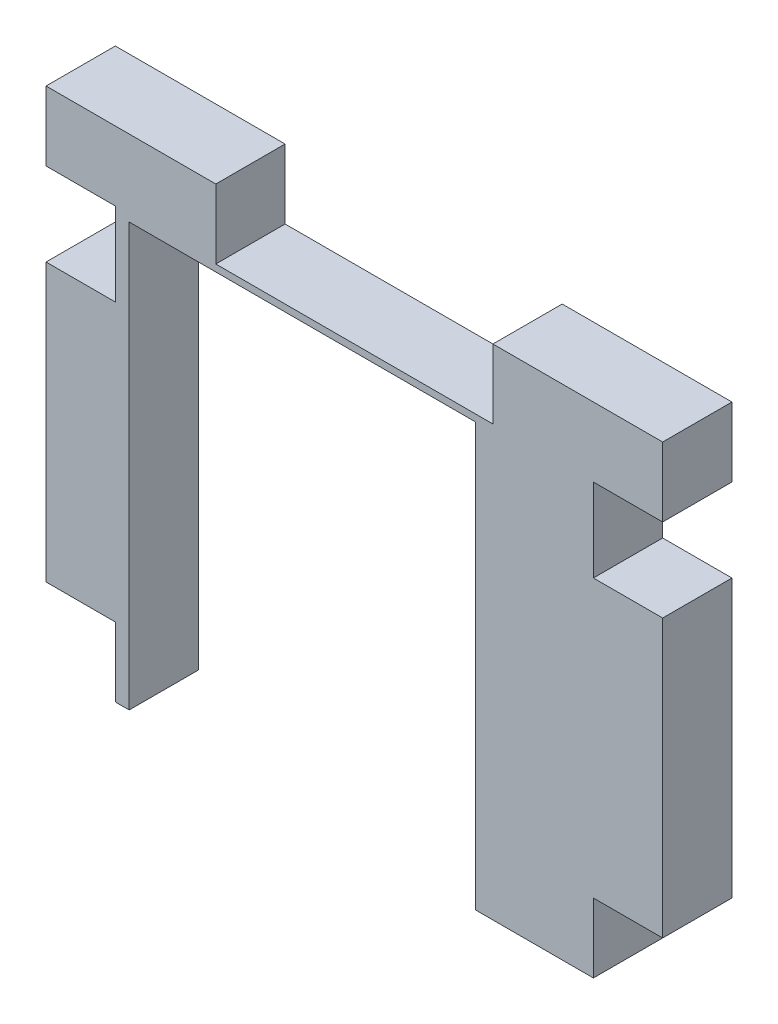
from build123d import *

# Parameters (mm, degrees)
BOSS_EXTRUDE1_DEPTH = 5


with BuildPart() as part:
    # Sketch1 → Boss-Extrude1 (new body)
    with BuildSketch(Plane.XY):
        Polygon((0, 36), (5, 36), (5, 30), (0, 30), (0, 10), (5, 10), (5, 5), (6, 5), (6, 35.5), (31, 35.5), (31, 5), (39.5, 5), (39.5, 10), (44.5, 10), (44.5, 30), (39.5, 30), (39.5, 36), (44.5, 36), (44.5, 41), (32.25, 41), (32.25, 36), (12.25, 36), (12.25, 41), (0, 41), align=None)
    extrude(amount=BOSS_EXTRUDE1_DEPTH)


solid = part.part
